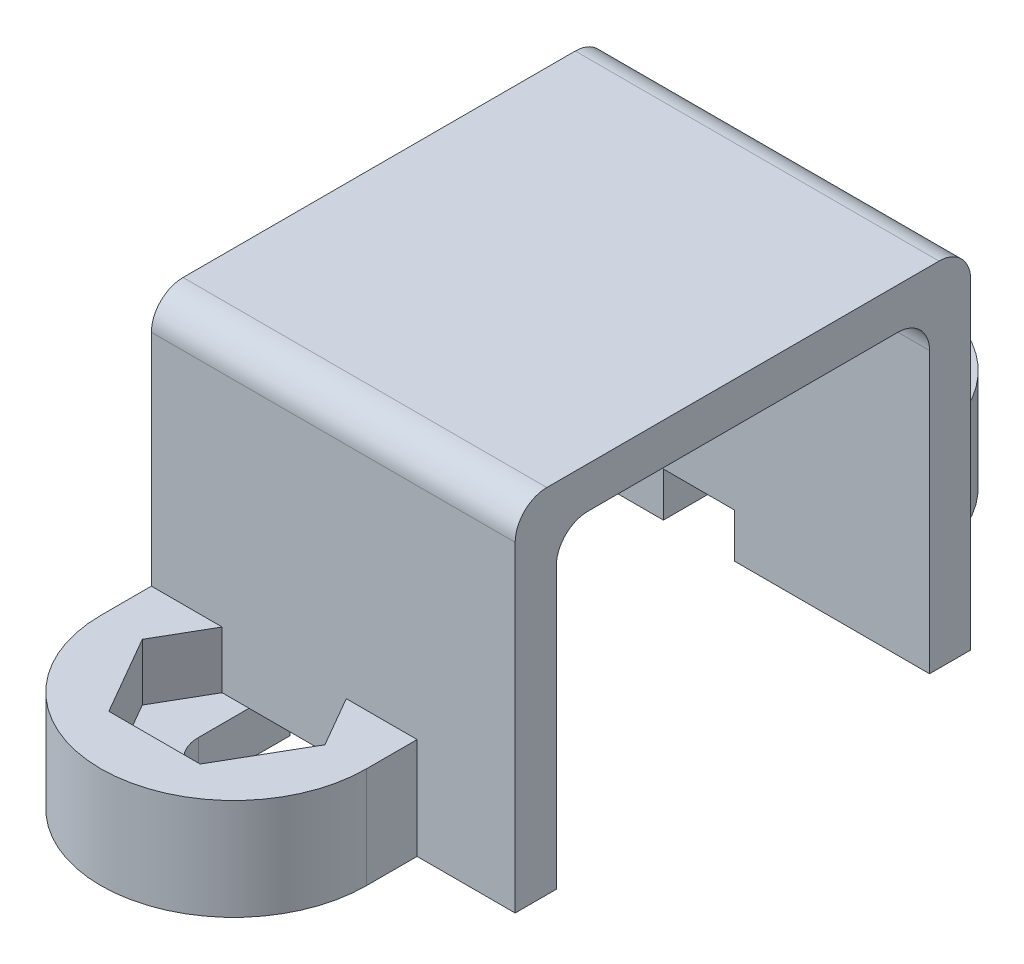
from build123d import *

# Parameters (mm, degrees)
EXTRUDE_1_DEPTH     = 11.5
FILLET_1_R          = 1
EXTRUDE_2_DEPTH     = 3.2
CUT_EXTRUDE_1_DEPTH = 1.8
CUT_EXTRUDE_2_DEPTH = 1.4


with BuildPart() as part:
    # 草图1 → 凸台-拉伸1 (new body)
    with BuildSketch(Plane(origin=(0, 0, 0), x_dir=(0, 0, -1), z_dir=(1, 0, 0))):
        Polygon((5.9, 0), (5.9, 9.85), (-5.9, 9.85), (-5.9, 0), (-7.2, 0), (-7.2, 11.15), (7.2, 11.15), (7.2, 0), align=None)
    extrude(amount=EXTRUDE_1_DEPTH)

    # 圆角1
    fillet_1_edges = [part.edges().sort_by_distance(p)[0] for p in [
        (5.75, 11.15, 7.2),
        (5.75, 11.15, -7.2),
        (5.75, 9.85, -5.9),
        (5.75, 9.85, 5.9),
    ]]
    fillet(fillet_1_edges, radius=FILLET_1_R)

    # 草图2 → 凸台-拉伸2 (add)
    with BuildSketch(Plane(origin=(0, 0, 0), x_dir=(1, 0, 0), z_dir=(0, 1, 0))):
        with BuildLine():
            Line((0, -7.2), (0, -8.8))
            ThreePointArc((0, -8.8), (4.2, -13), (8.4, -8.8))
            Line((8.4, -8.8), (8.4, -7.2))
            Line((8.4, -7.2), (0, -7.2))
        make_face()
    extrude_2 = extrude(amount=EXTRUDE_2_DEPTH)

    # 草图10 → 切除-拉伸1 (cut)
    with BuildSketch(Plane(origin=(0, 3.2, 0), x_dir=(1, 0, 0), z_dir=(0, 1, 0))):
        Polygon((7.085479679, -8.8), (6.161719249, -7.2), (2.235737418, -7.2), (1.311976987, -8.8), (2.75535266, -11.3), (5.642104006, -11.3), align=None)
    cut_extrude_1 = extrude(amount=-CUT_EXTRUDE_1_DEPTH, mode=Mode.SUBTRACT)

    # 草图11 → 切除-拉伸2 (cut)
    with BuildSketch(Plane(origin=(0, 0, 0), x_dir=(1, 0, 0), z_dir=(0, 1, 0))):
        with BuildLine():
            Line((3.087032009, -8.8), (3.087032009, -4.948738573))
            Line((3.087032009, -4.948738573), (5.337032009, -4.948738573))
            Line((5.337032009, -4.948738573), (5.337032009, -8.8))
            ThreePointArc((5.337032009, -8.8), (4.212032009, -9.925), (3.087032009, -8.8))
        make_face()
    cut_extrude_2 = extrude(amount=CUT_EXTRUDE_2_DEPTH, mode=Mode.SUBTRACT)

    # 镜向1: 凸台-拉伸2, 切除-拉伸1, 切除-拉伸2 across plane
    add(extrude_2.mirror(Plane.XY))
    add(cut_extrude_1.mirror(Plane.XY), mode=Mode.SUBTRACT)
    add(cut_extrude_2.mirror(Plane.XY), mode=Mode.SUBTRACT)


solid = part.part
